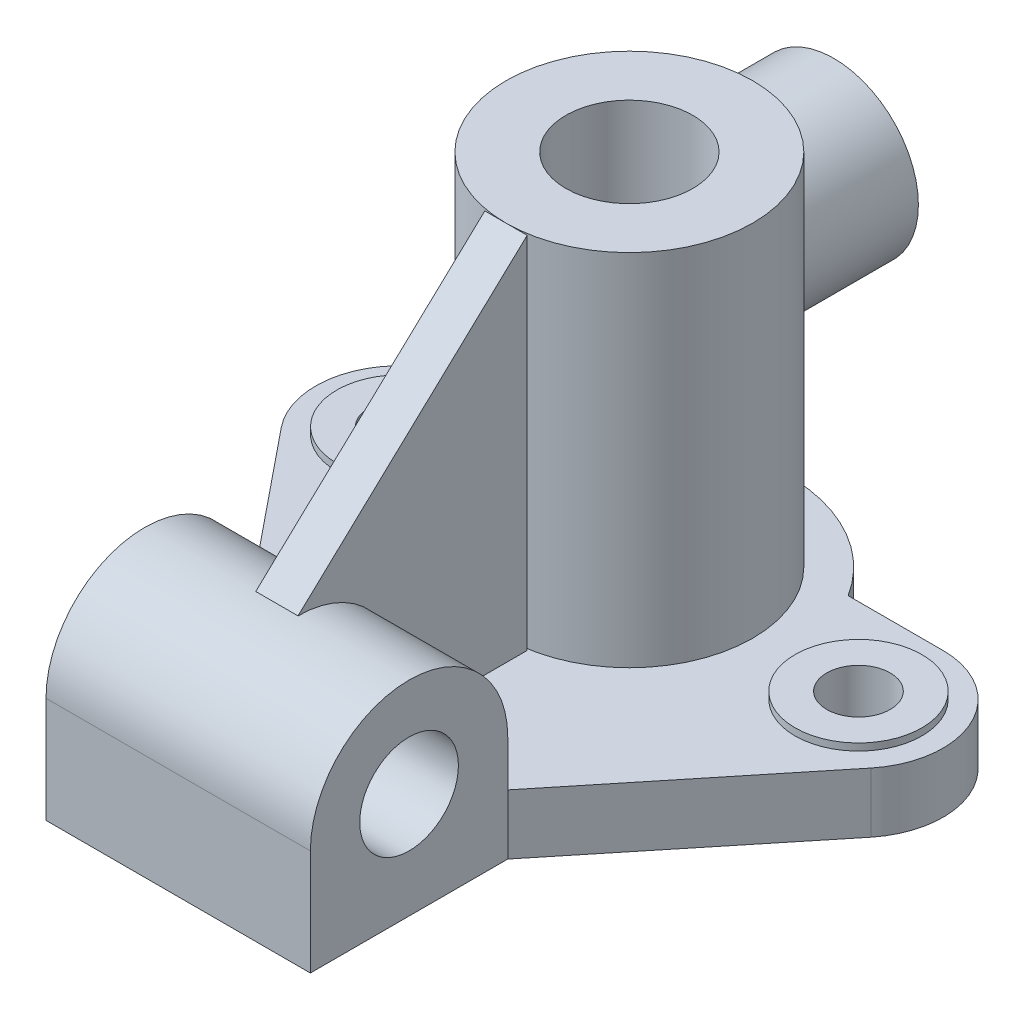
from build123d import *
from build123d.topology import SkipClean

# Parameters (mm, degrees)
SKETCH1_R             = 35
SKETCH1_R_2           = 18
BOSS_EXTRUDE1_DEPTH   = 17
BOSS_EXTRUDE1_2_DEPTH = 17
SKETCH1_4_R           = 18
SKETCH1_4_R_2         = 9
BOSS_EXTRUDE2_DEPTH   = 19
SKETCH1_6_R           = 35
SKETCH1_6_R_2         = 18
BOSS_EXTRUDE3_DEPTH   = 119
BOSS_EXTRUDE4_START   = -18
SKETCH4_R             = 24
SKETCH4_R_2           = 12.5
BOSS_EXTRUDE4_DEPTH   = 40
SKETCH5_W             = 75
SKETCH5_H             = 56
BOSS_EXTRUDE5_DEPTH   = 30
BOSS_EXTRUDE6_DEPTH   = 37.5
SKETCH6_3_R           = 14
CUT_EXTRUDE2_DEPTH    = 37.5
BOSS_EXTRUDE14_DEPTH  = 6


with BuildPart() as part:
    # Sketch1 → Boss-Extrude1 (new body)
    with BuildSketch(Plane(origin=(0, 0, 0), x_dir=(1, 0, 0), z_dir=(0, 1, 0))):
        with BuildLine():
            ThreePointArc((38.065732621, 24), (0, 45), (-38.065732621, 24))
            Line((-38.065732621, 24), (-65, 24))
            ThreePointArc((-65, 24), (-86.666308011, 10.323327815), (-83.639033344, -15.119075236))
            Line((-83.639033344, -15.119075236), (-37.5, -72))
            Line((-37.5, -72), (37.5, -72))
            Line((37.5, -72), (83.639033344, -15.119075236))
            ThreePointArc((83.639033344, -15.119075236), (86.666308011, 10.323327815), (65, 24))
            Line((65, 24), (38.065732621, 24))
        make_face()
        Circle(SKETCH1_R, mode=Mode.SUBTRACT)
        with Locations((65, 0)):
            Circle(SKETCH1_R_2, mode=Mode.SUBTRACT)
        with Locations((-65, 0)):
            Circle(SKETCH1_R_2, mode=Mode.SUBTRACT)
    extrude(amount=BOSS_EXTRUDE1_DEPTH)

    # Sketch1<4> → Boss-Extrude2 (add)
    # profile 1 of 2: a face of its own
    with BuildSketch(Plane(origin=(0, 0, 0), x_dir=(1, 0, 0), z_dir=(0, 1, 0))):
        with Locations((-65, 0)):
            Circle(SKETCH1_4_R)
        with Locations((-65, 0)):
            Circle(SKETCH1_4_R_2, mode=Mode.SUBTRACT)
    # profile 2 of 2: a face of its own
    with BuildSketch(Plane(origin=(0, 0, 0), x_dir=(1, 0, 0), z_dir=(0, 1, 0))):
        with Locations((65, 0)):
            Circle(SKETCH1_4_R)
        with Locations((65, 0)):
            Circle(SKETCH1_4_R_2, mode=Mode.SUBTRACT)
    extrude(amount=BOSS_EXTRUDE2_DEPTH)



with BuildPart() as body_2:
    # Sketch1 → Boss-Extrude1 2 (new body)
    with BuildSketch(Plane(origin=(0, 0, 0), x_dir=(1, 0, 0), z_dir=(0, 1, 0))):
        Circle(SKETCH1_R_2)
    extrude(amount=BOSS_EXTRUDE1_2_DEPTH)


with BuildPart() as part_1:
    add(part.part)

    add(body_2.part)  # Boss-Extrude3 merges body 2
    # Sketch1<6> → Boss-Extrude3 (add)
    with BuildSketch(Plane(origin=(0, 0, 0), x_dir=(1, 0, 0), z_dir=(0, 1, 0))):
        Circle(SKETCH1_6_R)
        Circle(SKETCH1_6_R_2, mode=Mode.SUBTRACT)
    extrude(amount=BOSS_EXTRUDE3_DEPTH)

    # Sketch4 → Boss-Extrude4 (add)
    with BuildSketch(Plane.XY.offset(BOSS_EXTRUDE4_START)):
        with Locations((0, 89)):
            Circle(SKETCH4_R)
        with Locations((0, 89)):
            Circle(SKETCH4_R_2, mode=Mode.SUBTRACT)
    extrude(amount=-BOSS_EXTRUDE4_DEPTH)

    # Sketch5 → Boss-Extrude5 (add)
    with BuildSketch(Plane(origin=(0, 0, 0), x_dir=(1, 0, 0), z_dir=(0, 1, 0))):
        with Locations((0, -100)):
            Rectangle(SKETCH5_W, SKETCH5_H)
    extrude(amount=BOSS_EXTRUDE5_DEPTH)

    # Sketch6 → Boss-Extrude6 (add, symmetric)
    with BuildSketch(Plane(origin=(0, 0, 0), x_dir=(0, 0, -1), z_dir=(1, 0, 0))):
        with BuildLine():
            ThreePointArc((-114, 30), (-100, 44), (-86, 30))
            Line((-86, 30), (-72, 30))
            ThreePointArc((-72, 30), (-100, 58), (-128, 30))
            Line((-128, 30), (-114, 30))
        make_face()
    extrude(amount=BOSS_EXTRUDE6_DEPTH, both=True)

    # Sketch6<3> → Cut-Extrude2 (cut, symmetric)
    with SkipClean():  # the faces are left unmerged after this step: merging them gives an invalid solid
        with BuildSketch(Plane(origin=(0, 0, 0), x_dir=(0, 0, -1), z_dir=(1, 0, 0))):
            with Locations((-100, 30)):
                Circle(SKETCH6_3_R)
        extrude(amount=CUT_EXTRUDE2_DEPTH, both=True, mode=Mode.SUBTRACT)


with BuildPart() as body_2_2:
    # Sketch9 → Boss-Extrude14 (new, symmetric)
    with BuildSketch(Plane(origin=(0, 0, 0), x_dir=(0, 0, -1), z_dir=(1, 0, 0))):
        with BuildLine():
            Line((-35, 119), (-35, 17))
            Line((-35, 17), (-72, 17))
            Line((-72, 17), (-72, 30))
            ThreePointArc((-72, 30), (-80.201010127, 49.798989873), (-100, 58))
            Line((-100, 58), (-35, 119))
        make_face()
    extrude(amount=BOSS_EXTRUDE14_DEPTH, both=True)


solid = Compound([part_1.part, body_2_2.part])
